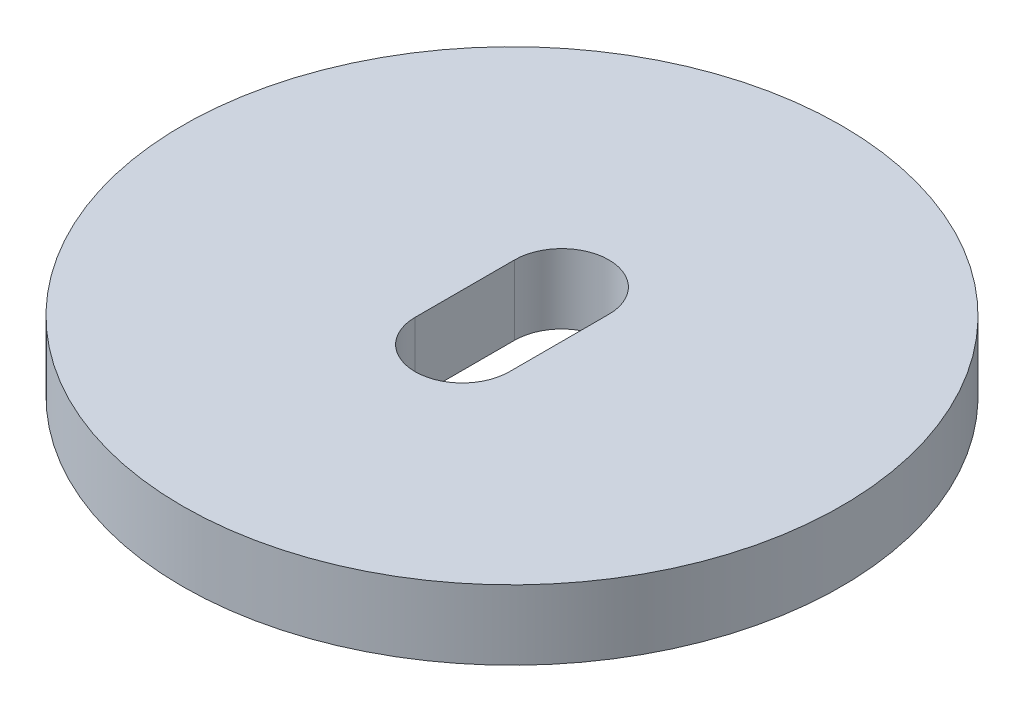
from build123d import *

# Parameters (mm, degrees)
SKETCH1_R           = 13.25
BOSS_EXTRUDE1_DEPTH = 2.8


with BuildPart() as part:
    # Sketch1 → Boss-Extrude1 (new body)
    with BuildSketch(Plane(origin=(0, 0, 0), x_dir=(1, 0, 0), z_dir=(0, 1, 0))):
        with Locations(Location((0, 0, 0), (0, 0, 270))):
            Circle(SKETCH1_R)
        with BuildLine():
            Line((-1.895, -2), (-1.895, 2))
            ThreePointArc((-1.895, 2), (0, 3.895), (1.895, 2))
            Line((1.895, 2), (1.895, -2))
            ThreePointArc((1.895, -2), (0, -3.895), (-1.895, -2))
        make_face(mode=Mode.SUBTRACT)
    extrude(amount=BOSS_EXTRUDE1_DEPTH)


solid = part.part
